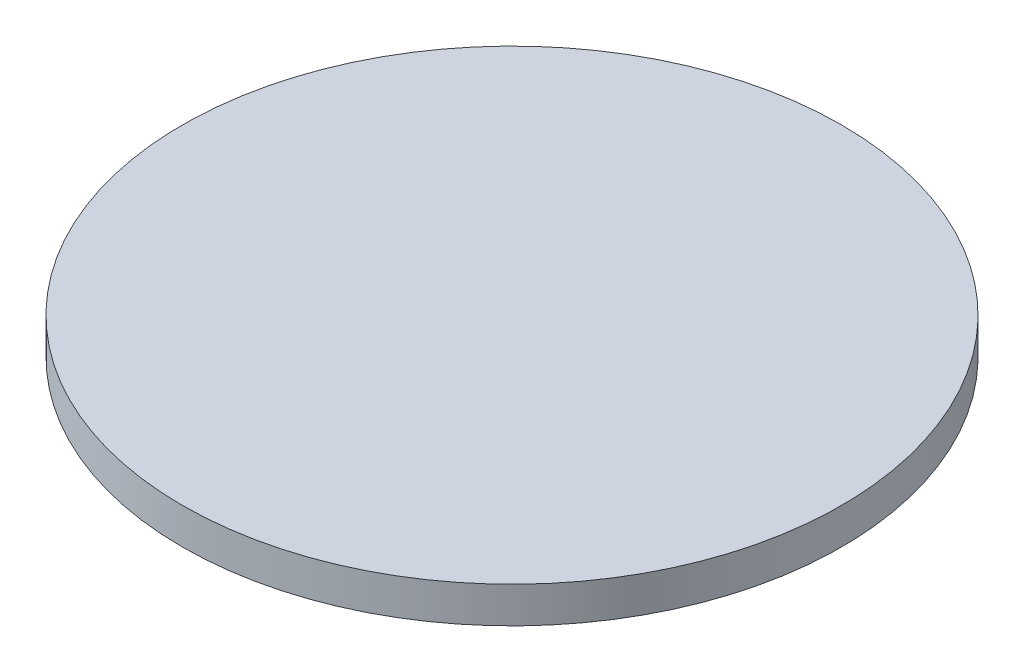
from build123d import *

# Parameters (mm, degrees)
SKETCH_1_W      = 137
SKETCH_1_H      = 15
SKETCH_2_R      = 114.5
EXTRUDE_1_DEPTH = 8
SKETCH_3_R      = 82.5
EXTRUDE_2_DEPTH = 8


with BuildPart() as part:
    # 草圖1 → 旋轉1 (revolve)
    with BuildSketch(Plane(origin=(0, 0, 0), x_dir=(-1, 0, 0), z_dir=(0, 0, -1)), mode=Mode.PRIVATE) as revolve_1_sk:
        with Locations((-68.5, 35.5)):
            Rectangle(SKETCH_1_W, SKETCH_1_H)
    revolve(revolve_1_sk.sketch.rotate(Axis((0, 28, 0), (0, 1, 0)), 270), axis=Axis((0, 28, 0), (0, 1, 0)))

    # 草圖2 → 填料-伸長1 (add)
    with BuildSketch(Plane.XZ.offset(-28)):
        with Locations(Location((0, 0, 0), (0, 0, 270))):
            Circle(SKETCH_2_R)
    extrude(amount=EXTRUDE_1_DEPTH)

    # 草圖3 → 填料-伸長2 (add)
    with BuildSketch(Plane.XZ.offset(-20)):
        with Locations(Location((0, 0, 0), (0, 0, 270))):
            Circle(SKETCH_3_R)
    extrude(amount=EXTRUDE_2_DEPTH)


solid = part.part
